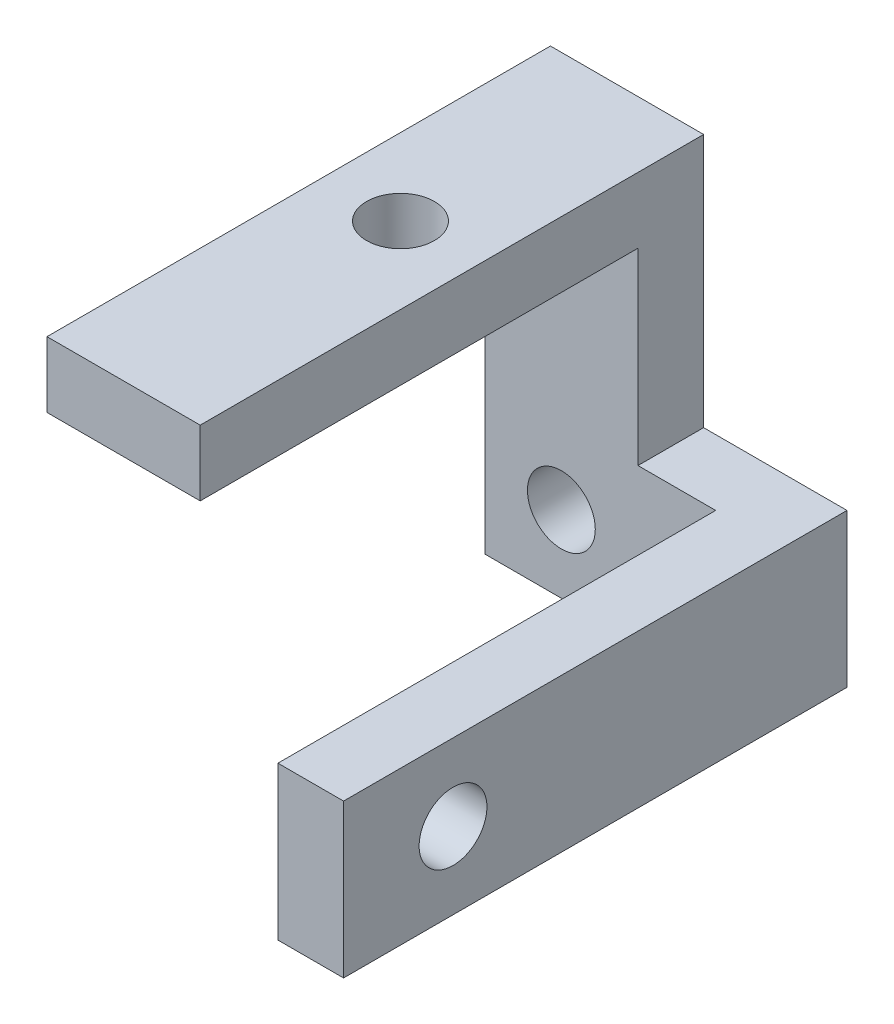
from build123d import *

# Parameters (mm, degrees)
ESQUISSE1_W             = 7
ESQUISSE1_H             = 11.6
ESQUISSE1_H_2           = 7
ESQUISSE1_W_2           = 6.55
BOSS_EXTRU_1_DEPTH      = 3
ESQUISSE2_W             = 7
ESQUISSE2_H             = 3
BOSS_EXTRU_2_DEPTH      = 20
ESQUISSE3_W             = 3
ESQUISSE3_H             = 7
BOSS_EXTRU_3_DEPTH      = 20
ESQUISSE4_R             = 1.55
ENL_V_MAT_EXTRU_1_DEPTH = 20
ESQUISSE5_R             = 1.55
ENL_V_MAT_EXTRU_2_DEPTH = 20
ESQUISSE6_R             = 1.55
ENL_V_MAT_EXTRU_3_DEPTH = 20


with BuildPart() as part:
    # Esquisse1 → Boss.-Extru.1 (new body)
    with BuildSketch(Plane.XY):
        with Locations((3.5, 12.8)):
            Rectangle(ESQUISSE1_W, ESQUISSE1_H)
        with Locations((3.5, 3.5)):
            Rectangle(ESQUISSE1_W, ESQUISSE1_H_2)
        with Locations((10.275, 3.5)):
            Rectangle(ESQUISSE1_W_2, ESQUISSE1_H_2)
    extrude(amount=BOSS_EXTRU_1_DEPTH)

    # Esquisse2 → Boss.-Extru.2 (add)
    with BuildSketch(Plane.XY.offset(3)):
        with Locations((3.5, 17.1)):
            Rectangle(ESQUISSE2_W, ESQUISSE2_H)
    extrude(amount=BOSS_EXTRU_2_DEPTH)

    # Esquisse3 → Boss.-Extru.3 (add)
    with BuildSketch(Plane.XY.offset(3)):
        with Locations((12.05, 3.5)):
            Rectangle(ESQUISSE3_W, ESQUISSE3_H)
    extrude(amount=BOSS_EXTRU_3_DEPTH)

    # Esquisse4 → Enlèv. mat.-Extru.1 (cut)
    with BuildSketch(Plane.XZ.offset(-15.6)):
        with Locations(Location((3.5, 10.35, 0), (0, 0, 270))):
            Circle(ESQUISSE4_R)
    extrude(amount=-ENL_V_MAT_EXTRU_1_DEPTH, mode=Mode.SUBTRACT)

    # Esquisse5 → Enlèv. mat.-Extru.2 (cut)
    with BuildSketch(Plane.ZY.offset(-10.55)):
        with Locations((18, 3.5)):
            Circle(ESQUISSE5_R)
    extrude(amount=-ENL_V_MAT_EXTRU_2_DEPTH, mode=Mode.SUBTRACT)

    # Esquisse6 → Enlèv. mat.-Extru.3 (cut)
    with BuildSketch(Plane.XY.offset(3)):
        with Locations((3.5, 3.5)):
            Circle(ESQUISSE6_R)
    extrude(amount=-ENL_V_MAT_EXTRU_3_DEPTH, mode=Mode.SUBTRACT)


solid = part.part
